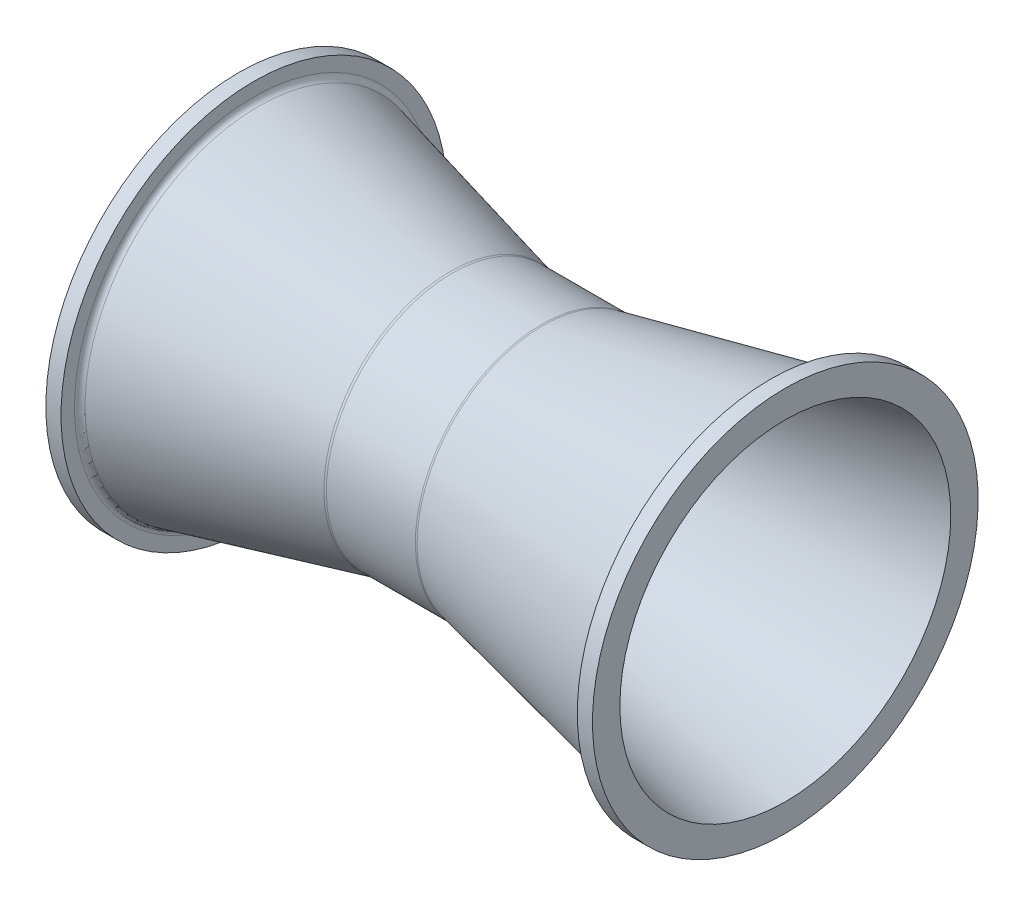
from build123d import *

# Parameters (mm, degrees)
SKETCH1_R           = 37.5
SKETCH1_R_2         = 4
SKETCH1_R_3         = 15
BOSS_EXTRUDE1_DEPTH = 6
FILLET1_R           = 2
FILLET2_R           = 3


with BuildPart() as part:
    # Sketch1 → Boss-Extrude1 (new body)
    with BuildSketch(Plane(origin=(0, 0, 0), x_dir=(0, 0, -1), z_dir=(1, 0, 0))):
        Circle(SKETCH1_R)
        with Locations((29, 0)):
            Circle(SKETCH1_R_2, mode=Mode.SUBTRACT)
        with Locations((-14.5, -25.11473671)):
            Circle(SKETCH1_R_2, mode=Mode.SUBTRACT)
        with Locations((-14.5, 25.11473671)):
            Circle(SKETCH1_R_2, mode=Mode.SUBTRACT)
        Circle(SKETCH1_R_3, mode=Mode.SUBTRACT)
    extrude(amount=BOSS_EXTRUDE1_DEPTH)

    # Sketch2 → Revolve1 (revolve)
    with BuildSketch(Plane.XY):
        Polygon((-65, 63.5), (-70, 63.5), (-70, 54.730769231), (0, 37.5), (30.42191957, 37.5), (110, 54.476657158), (110, 63.5), (105, 63.5), (105, 57.5), (30, 41.5), (0, 41.5), (-65, 57.5), align=None)
    revolve(axis=Axis((0, 0, 0), (-1, 0, 0)))

    # Fillet1
    fillet1_edges = [part.edges().sort_by_distance(p)[0] for p in [
        (105, -57.5, 0),
        (-65, -57.5, 0),
    ]]
    fillet(fillet1_edges, radius=FILLET1_R)

    # Fillet2
    fillet2_edges = [part.edges().sort_by_distance(p)[0] for p in [
        (30, -41.5, 0),
        (0, -41.5, 0),
    ]]
    fillet(fillet2_edges, radius=FILLET2_R)


solid = part.part
